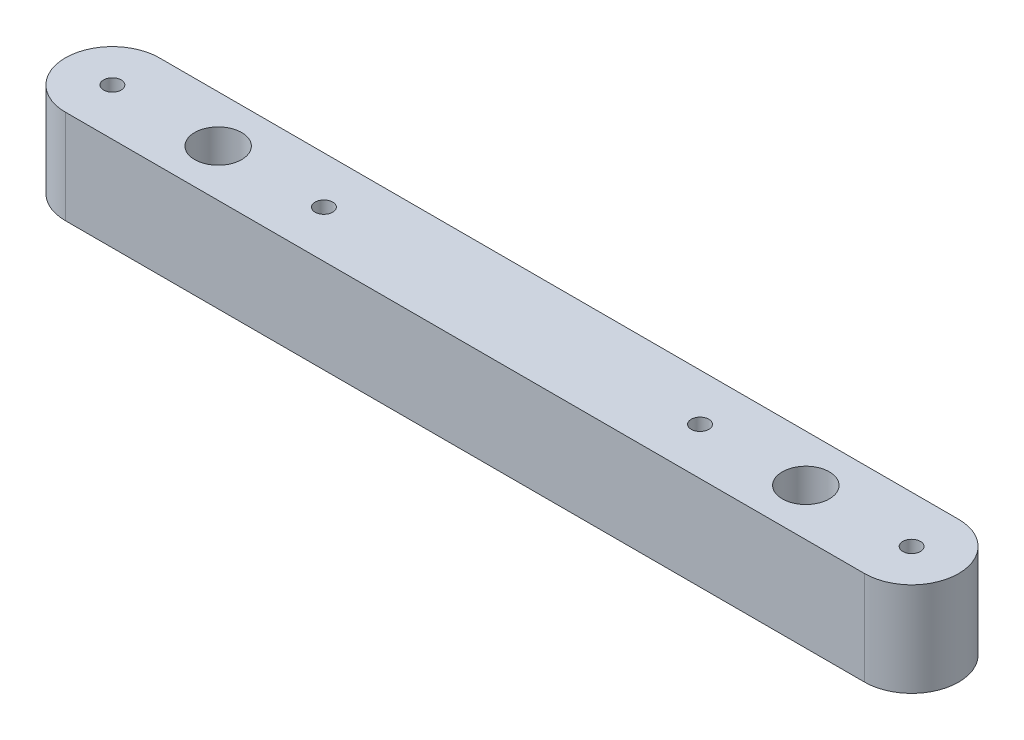
from build123d import *

# Parameters (mm, degrees)
SKETCH_1_R      = 0.75
SKETCH_1_R_2    = 2
EXTRUDE_1_DEPTH = 8


with BuildPart() as part:
    # 草圖1 → 填料-伸長1 (new body)
    with BuildSketch(Plane(origin=(0, 0, 0), x_dir=(1, 0, 0), z_dir=(0, 1, 0))):
        with BuildLine():
            Line((-0.414012206, -4), (25, -4))
            Line((25, -4), (34, -4))
            ThreePointArc((34, -4), (38, 0), (34, 4))
            Line((34, 4), (25, 4))
            Line((25, 4), (-0.414012206, 4))
            Line((-0.414012206, 4), (-34, 4))
            ThreePointArc((-34, 4), (-38, 0), (-34, -4))
            Line((-34, -4), (-0.414012206, -4))
        make_face()
        with Locations(Location((34, 0, 0), (0, 0, 270))):
            Circle(SKETCH_1_R, mode=Mode.SUBTRACT)
        with Locations(Location((-34, 0, 0), (0, 0, 270))):
            Circle(SKETCH_1_R, mode=Mode.SUBTRACT)
        with Locations(Location((-25, 0, 0), (0, 0, 270))):
            Circle(SKETCH_1_R_2, mode=Mode.SUBTRACT)
        with Locations(Location((25, 0, 0), (0, 0, 270))):
            Circle(SKETCH_1_R_2, mode=Mode.SUBTRACT)
        with Locations(Location((-16, 0, 0), (0, 0, 270))):
            Circle(SKETCH_1_R, mode=Mode.SUBTRACT)
        with Locations(Location((16, 0, 0), (0, 0, 270))):
            Circle(SKETCH_1_R, mode=Mode.SUBTRACT)
    extrude(amount=EXTRUDE_1_DEPTH)


solid = part.part
